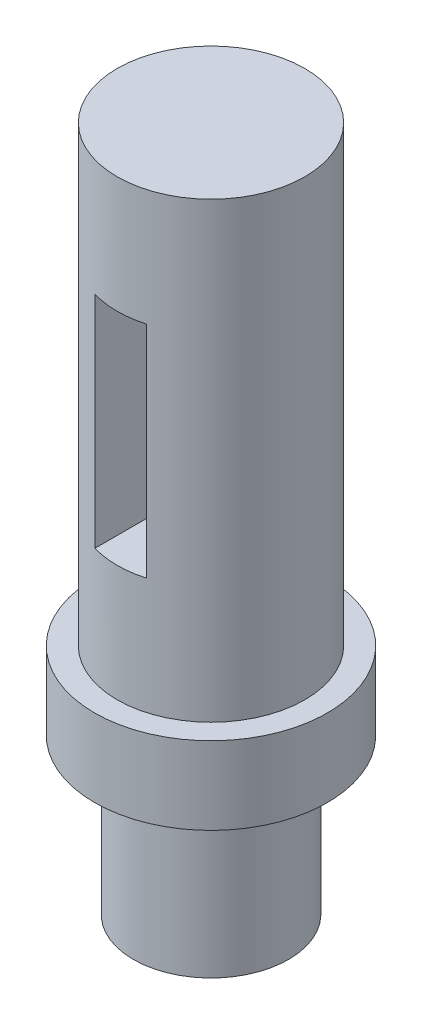
from build123d import *

# Parameters (mm, degrees)
SKETCH1_R               = 12
BOSS_EXTRUDE1_DEPTH     = 24
BOSS_EXTRUDE2_START     = 12
SKETCH1_4_R             = 18
SKETCH1_4_R_2           = 14.5
SKETCH1_4_R_3           = 12
BOSS_EXTRUDE2_DEPTH     = 12
BOSS_EXTRUDE4_START     = 12
SKETCH1_8_R             = 14.5
BOSS_EXTRUDE4_DEPTH     = 70
CUT_EXTRUDE1_DEPTH      = 86.860351735
CUT_EXTRUDE1_DEPTH_BACK = 86.860351735
SKETCH2_W               = 8
SKETCH2_H               = 34


with BuildPart() as part:
    # Sketch1 → Boss-Extrude1 (new body)
    with BuildSketch(Plane(origin=(0, 0, 0), x_dir=(1, 0, 0), z_dir=(0, 1, 0))):
        with Locations(Location((0, 0, 0), (0, 0, 270))):
            Circle(SKETCH1_R)
    extrude(amount=-BOSS_EXTRUDE1_DEPTH)

    # Sketch1<4> → Boss-Extrude2 (add)
    # profile 1 of 3: a face of its own
    with BuildSketch(Plane(origin=(0, 0, 0), x_dir=(1, 0, 0), z_dir=(0, 1, 0)).offset(BOSS_EXTRUDE2_START)):
        with Locations(Location((0, 0, 0), (0, 0, 270))):
            Circle(SKETCH1_4_R)
        Circle(SKETCH1_4_R_2, mode=Mode.SUBTRACT)
    # profile 2 of 3: a face of its own
    with BuildSketch(Plane(origin=(0, 0, 0), x_dir=(1, 0, 0), z_dir=(0, 1, 0)).offset(BOSS_EXTRUDE2_START)):
        Circle(SKETCH1_4_R_2)
        with Locations(Location((0, 0, 0), (0, 0, 270))):
            Circle(SKETCH1_4_R_3, mode=Mode.SUBTRACT)
    # profile 3 of 3: a face of its own
    with BuildSketch(Plane(origin=(0, 0, 0), x_dir=(1, 0, 0), z_dir=(0, 1, 0)).offset(BOSS_EXTRUDE2_START)):
        with Locations(Location((0, 0, 0), (0, 0, 270))):
            Circle(SKETCH1_4_R_3)
    extrude(amount=-BOSS_EXTRUDE2_DEPTH)

    # Sketch1<8> → Boss-Extrude4 (add)
    with BuildSketch(Plane(origin=(0, 0, 0), x_dir=(1, 0, 0), z_dir=(0, 1, 0)).offset(BOSS_EXTRUDE4_START)):
        with Locations(Location((0, 0, 0), (0, 0, 270))):
            Circle(SKETCH1_8_R)
    extrude(amount=BOSS_EXTRUDE4_DEPTH)

    # Sketch2 → Cut-Extrude1 (cut, two sides: drawn at the far end of the back side and taken through both)
    with BuildSketch(Plane.XY.offset(-CUT_EXTRUDE1_DEPTH_BACK)):
        with Locations((0, 47)):
            Rectangle(SKETCH2_W, SKETCH2_H)
    extrude(amount=CUT_EXTRUDE1_DEPTH + CUT_EXTRUDE1_DEPTH_BACK, mode=Mode.SUBTRACT)


solid = part.part
